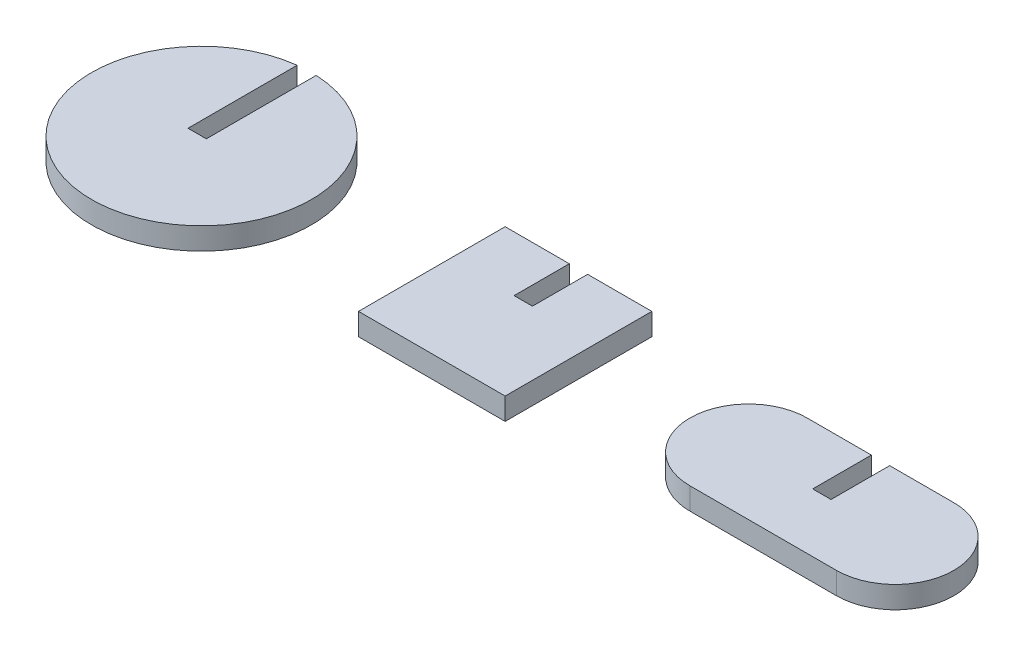
from build123d import *

# Parameters (mm, degrees)
BOSS_EXTRUDE1_DEPTH   = 3
BOSS_EXTRUDE1_2_DEPTH = 3
BOSS_EXTRUDE1_3_DEPTH = 3


with BuildPart() as part:
    # Sketch1 → Boss-Extrude1 (new body)
    with BuildSketch(Plane(origin=(0, 0, 0), x_dir=(1, 0, 0), z_dir=(0, 1, 0))):
        with BuildLine():
            Line((28.435413078, 13.077958274), (28.435413078, -1.808926439))
            Line((28.435413078, -1.808926439), (30.935413078, -1.808926439))
            Line((30.935413078, -1.808926439), (30.935413078, 13.176487365))
            ThreePointArc((30.935413078, 13.176487365), (30.864787109, -16.797290414), (28.435413078, 13.077958274))
        make_face()
    extrude(amount=BOSS_EXTRUDE1_DEPTH)


with BuildPart() as body_2:
    # Sketch1 → Boss-Extrude1 2 (new body)
    with BuildSketch(Plane(origin=(0, 0, 0), x_dir=(1, 0, 0), z_dir=(0, 1, 0))):
        Polygon((61.687252638, -11.808926439), (81.687252638, -11.808926439), (81.687252638, 8.191073561), (72.937252638, 8.191073561), (72.937252638, 0.658425471), (70.437252638, 0.658425471), (70.437252638, 8.191073561), (61.687252638, 8.191073561), align=None)
    extrude(amount=BOSS_EXTRUDE1_2_DEPTH)


with BuildPart() as body_3:
    # Sketch1 → Boss-Extrude1 3 (new body)
    with BuildSketch(Plane(origin=(0, 0, 0), x_dir=(1, 0, 0), z_dir=(0, 1, 0))):
        with BuildLine():
            Line((104.876295826, 6.191073561), (113.626295826, 6.191073561))
            Line((113.626295826, 6.191073561), (113.626295826, -1.808926439))
            Line((113.626295826, -1.808926439), (116.126295826, -1.808926439))
            Line((116.126295826, -1.808926439), (116.126295826, 6.191073561))
            Line((116.126295826, 6.191073561), (124.876295826, 6.191073561))
            ThreePointArc((124.876295826, 6.191073561), (132.876295826, -1.808926439), (124.876295826, -9.808926439))
            Line((124.876295826, -9.808926439), (104.876295826, -9.808926439))
            ThreePointArc((104.876295826, -9.808926439), (96.876295826, -1.808926439), (104.876295826, 6.191073561))
        make_face()
    extrude(amount=BOSS_EXTRUDE1_3_DEPTH)


solid = Compound([part.part, body_2.part, body_3.part])
